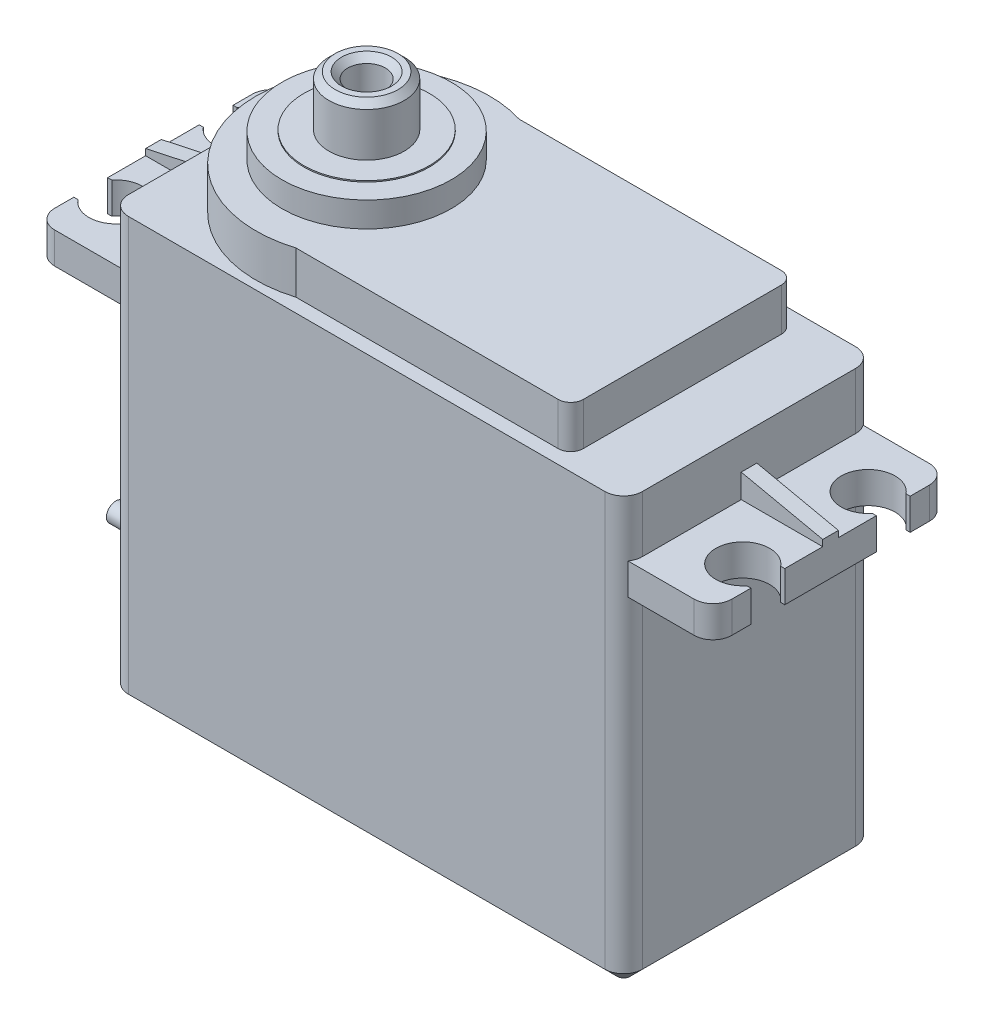
from build123d import *

# Parameters (mm, degrees)
SKETCH1_W          = 41
SKETCH1_H          = 34
EXTRUDE1_DEPTH     = 10
EXTRUDE2_DEPTH     = 3.4
SKETCH4_R          = 3
SKETCH4_R_2        = 1.5
EXTRUDE3_DEPTH     = 4
FILLET1_R          = 1.5
EXTRUDE4_DEPTH     = 2.5
EXTRUDE5_DEPTH     = 0.625
SKETCH8_R          = 0.75
EXTRUDE6_DEPTH     = 8
SKETCH9_R          = 0.75
EXTRUDE7_DEPTH     = 8
SKETCH10_R         = 0.75
EXTRUDE8_DEPTH     = 8
CHAMFER1_SIZE      = 1
CHAMFER2_SIZE      = 0.5
SKETCH11_R         = 1.5
CUT_EXTRUDE1_DEPTH = 5


with BuildPart() as part:
    # Sketch1 → Extrude1 (new, symmetric)
    with BuildSketch(Plane.XY):
        Rectangle(SKETCH1_W, SKETCH1_H)
    extrude(amount=EXTRUDE1_DEPTH, both=True)

    # Sketch2 → Extrude2 (add)
    with BuildSketch(Plane(origin=(0, 17, 0), x_dir=(1, 0, 0), z_dir=(0, 1, 0))):
        with BuildLine():
            Line((-6.733702836, -8.9), (14.18, -8.9))
            ThreePointArc((14.18, -8.9), (14.887106781, -8.607106781), (15.18, -7.9))
            Line((15.18, -7.9), (15.18, 7.9))
            ThreePointArc((15.18, 7.9), (14.887106781, 8.607106781), (14.18, 8.9))
            Line((14.18, 8.9), (-6.733702836, 8.9))
            ThreePointArc((-6.733702836, 8.9), (-18.82, 0), (-6.733702836, -8.9))
        make_face()
    extrude(amount=EXTRUDE2_DEPTH)

    # Sketch3 → Revolve1 (revolve)
    with BuildSketch(Plane.XY, mode=Mode.PRIVATE) as revolve1_sk:
        Polygon((-10, 20.4), (-16.75, 20.4), (-16.75, 22.4), (-15, 22.4), (-15, 22.5), (-10, 22.5), align=None)
    revolve(revolve1_sk.sketch.rotate(Axis((-10, 22.5, 0), (0, -1, 0)), 270), axis=Axis((-10, 22.5, 0), (0, -1, 0)))

    # Fillet1
    fillet1_edges = [part.edges().sort_by_distance(p)[0] for p in [
        (20.5, 0, 10),
        (-20.5, 0, 10),
        (20.5, 0, -10),
        (-20.5, 0, -10),
    ]]
    fillet(fillet1_edges, radius=FILLET1_R)

    # Sketch6 → Extrude4 (add)
    with BuildSketch(Plane(origin=(0, 12.5, 0), x_dir=(-1, 0, 0), z_dir=(0, 1, 0))):
        with BuildLine():
            Line((27, 0), (27, 3.65))
            Line((27, 3.65), (26.673320053, 3.65))
            ThreePointArc((26.673320053, 3.65), (22.85, 5), (26.673320053, 6.35))
            Line((26.673320053, 6.35), (27, 6.35))
            Line((27, 6.35), (27, 7.875))
            ThreePointArc((27, 7.875), (26.560660172, 8.935660172), (25.5, 9.375))
            Line((25.5, 9.375), (20.218349293, 9.375))
            ThreePointArc((20.218349293, 9.375), (20.427852223, 8.959606386), (20.5, 8.5))
            Line((20.5, 8.5), (20.5, 0))
            Line((20.5, 0), (20.5, -8.5))
            ThreePointArc((20.5, -8.5), (20.427852223, -8.959606386), (20.218349293, -9.375))
            Line((20.218349293, -9.375), (25.5, -9.375))
            ThreePointArc((25.5, -9.375), (26.560660172, -8.935660172), (27, -7.875))
            Line((27, -7.875), (27, -6.35))
            Line((27, -6.35), (26.673320053, -6.35))
            ThreePointArc((26.673320053, -6.35), (22.85, -5), (26.673320053, -3.65))
            Line((26.673320053, -3.65), (27, -3.65))
            Line((27, -3.65), (27, 0))
        make_face()
    extrude4 = extrude(amount=-EXTRUDE4_DEPTH)

    # Sketch7 → Extrude5 (add, symmetric)
    with BuildSketch(Plane.XY):
        Polygon((-20.5, 14.4), (-27, 13), (-27, 12.5), (-20.5, 12.5), align=None)
    extrude5 = extrude(amount=EXTRUDE5_DEPTH, both=True)

    # Mirror1: Extrude4, Extrude5 across plane
    add(extrude4.mirror(Plane(origin=(0, 0, 0), x_dir=(0, 0, 1), z_dir=(1, 0, 0))))
    add(extrude5.mirror(Plane(origin=(0, 0, 0), x_dir=(0, 0, 1), z_dir=(1, 0, 0))))

    # Chamfer1
    chamfer1_edges = [part.edges().sort_by_distance(p)[0] for p in [
        (20.5, -17, 0),
        (0, -17, -10),
        (0, -17, 10),
        (-20.5, -17, 0),
        (-20.060660172, -17, 9.560660172),
        (-20.060660172, -17, -9.560660172),
        (20.060660172, -17, 9.560660172),
        (20.060660172, -17, -9.560660172),
    ]]
    chamfer(chamfer1_edges, length=CHAMFER1_SIZE)

    # Sketch11 → Cut-Extrude1 (cut)
    with BuildSketch(Plane.ZY.offset(20.5)):
        Circle(SKETCH11_R)
    extrude(amount=-CUT_EXTRUDE1_DEPTH, mode=Mode.SUBTRACT)


with BuildPart() as body_2:
    # Sketch4 → Extrude3 (new body)
    with BuildSketch(Plane(origin=(0, 22.5, 0), x_dir=(1, 0, 0), z_dir=(0, 1, 0))):
        with Locations(Location((-10, 0, 0), (0, 0, 270))):
            Circle(SKETCH4_R)
        with Locations(Location((-10, 0, 0), (0, 0, 270))):
            Circle(SKETCH4_R_2, mode=Mode.SUBTRACT)
    extrude(amount=EXTRUDE3_DEPTH)

    # Chamfer2
    chamfer2_edges = [body_2.edges().sort_by_distance(p)[0] for p in [
        (-10, 26.5, -3),
        (-10, 26.5, -1.5),
    ]]
    chamfer(chamfer2_edges, length=CHAMFER2_SIZE)


with BuildPart() as body_3:
    # Sketch8 → Extrude6 (new body)
    with BuildSketch(Plane.ZY.offset(20.5)):
        with Locations((0, -12.4)):
            Circle(SKETCH8_R)
    extrude(amount=EXTRUDE6_DEPTH)


with BuildPart() as body_4:
    # Sketch9 → Extrude7 (new body)
    with BuildSketch(Plane.ZY.offset(20.5)):
        with Locations((1.5, -12.4)):
            Circle(SKETCH9_R)
    extrude(amount=EXTRUDE7_DEPTH)


with BuildPart() as body_5:
    # Sketch10 → Extrude8 (new body)
    with BuildSketch(Plane.ZY.offset(20.5)):
        with Locations((-1.5, -12.4)):
            Circle(SKETCH10_R)
    extrude(amount=EXTRUDE8_DEPTH)


solid = Compound([part.part, body_2.part, body_3.part, body_4.part, body_5.part])
